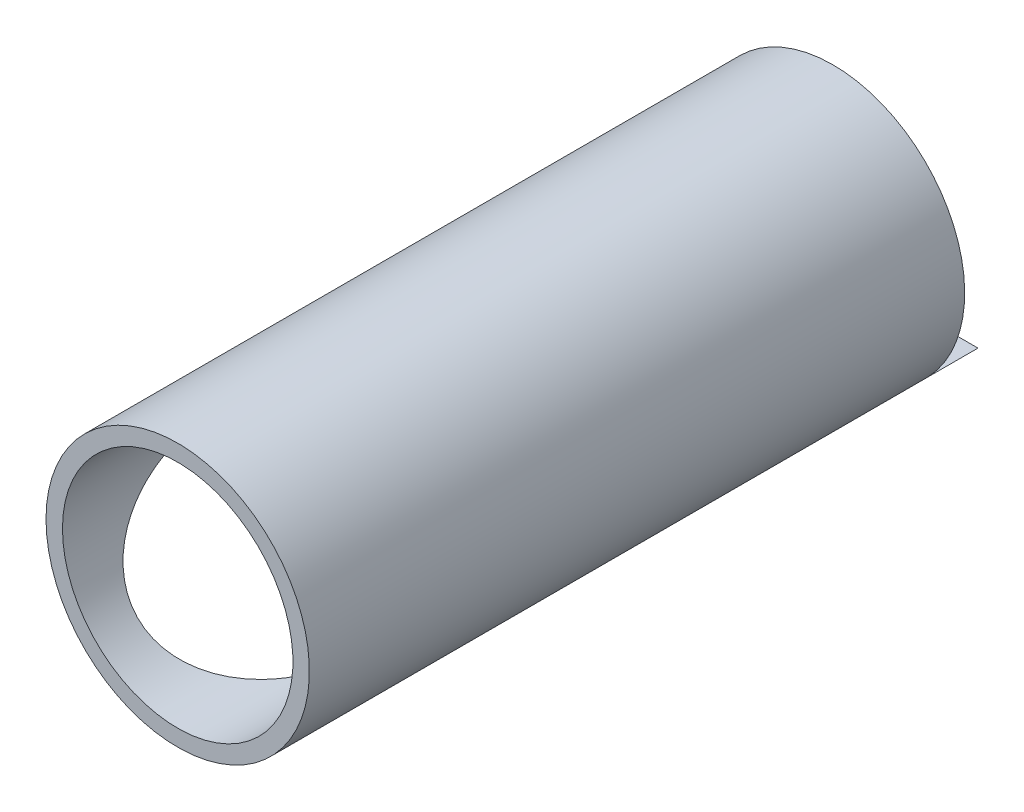
from build123d import *

# Parameters (mm, degrees)
SKETCH1_R               = 25.4
SKETCH1_R_2             = 22.225
BOSS_EXTRUDE1_DEPTH     = 914.4
CUT_EXTRUDE1_START      = -152.4
SKETCH2_R               = 25.4
CUT_EXTRUDE1_DEPTH      = 763.70528356
CUT_EXTRUDE2_DEPTH      = 148.321368528
SKETCH4_W               = 50.8
SKETCH4_H               = 16.486891384
CUT_EXTRUDE3_DEPTH      = 163.639355631
CUT_EXTRUDE4_REACH      = 151.106
CUT_EXTRUDE4_END_RADIUS = 22.225
SKETCH5_R               = 19.05


with BuildPart() as part:
    # Sketch1 → Boss-Extrude1 (new body)
    with BuildSketch(Plane.XY):
        Circle(SKETCH1_R)
        Circle(SKETCH1_R_2, mode=Mode.SUBTRACT)
    extrude(amount=BOSS_EXTRUDE1_DEPTH)

    # Sketch2 → Cut-Extrude1 (cut, through all)
    with BuildSketch(Plane(origin=(0, 0, 0), x_dir=(-1, 0, 0), z_dir=(0, 0, -1)).offset(CUT_EXTRUDE1_START)):
        Circle(SKETCH2_R)
    extrude(amount=-CUT_EXTRUDE1_DEPTH, mode=Mode.SUBTRACT)

    # Sketch3 → Cut-Extrude2 (cut, through all)
    with BuildSketch(Plane(origin=(0, 0, 9.525), x_dir=(-1, 0, 0), z_dir=(0, 0, -1))):
        with BuildLine():
            Line((-18.445083186, -17.4625), (18.445083186, -17.4625))
            ThreePointArc((18.445083186, -17.4625), (0, 25.4), (-18.445083186, -17.4625))
        make_face()
    extrude(amount=CUT_EXTRUDE2_DEPTH, mode=Mode.SUBTRACT)

    # Sketch4 → Cut-Extrude3 (cut, through all)
    with BuildSketch(Plane(origin=(0, 25.4, 0), x_dir=(1, 0, 0), z_dir=(0, 1, 0))):
        with Locations((0, -144.156554308)):
            Rectangle(SKETCH4_W, SKETCH4_H)
    extrude(amount=-CUT_EXTRUDE3_DEPTH, mode=Mode.SUBTRACT)

    # Cut-Extrude4: up to this cylinder (the profile starts outside it)
    cut_extrude4_end = Plane(origin=(0, 0, 108.847618), z_dir=(0, 0, -1)) * Cylinder(CUT_EXTRUDE4_END_RADIUS, 347.662, mode=Mode.PRIVATE)
    # Sketch5 → Cut-Extrude4 (cut, up to the surface)
    with BuildSketch(Plane(origin=(-17.960512242, -17.960512242, 0), x_dir=(0, 0, -1), z_dir=(-0.7071067811865464, -0.7071067811865488, 0)), mode=Mode.PRIVATE) as cut_extrude4_sk1:
        with Locations(Location((-108.847617901, 0, 0), (0, 0, 90))):
            Circle(SKETCH5_R)
    cut_extrude4_tool1 = extrude(cut_extrude4_sk1.sketch, amount=-CUT_EXTRUDE4_REACH, mode=Mode.PRIVATE) - cut_extrude4_end
    add(cut_extrude4_tool1.solids().sort_by_distance((-17.960512, -17.960512, 108.847618))[0], mode=Mode.SUBTRACT)


solid = part.part
